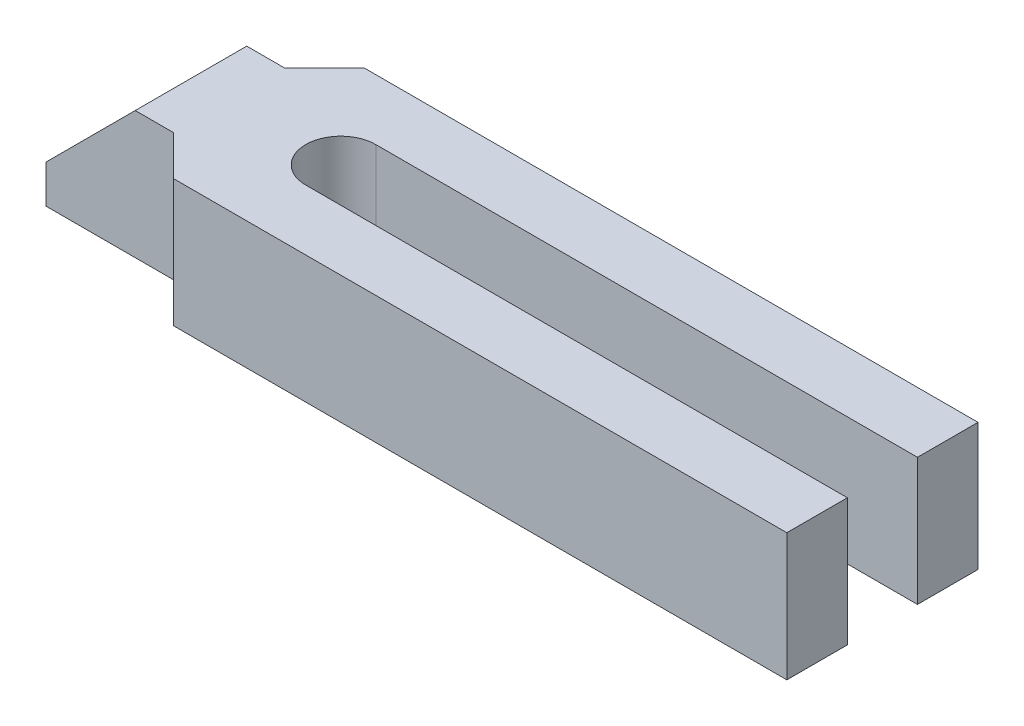
from build123d import *

# Parameters (mm, degrees)
BOSS_EXTRUDE1_DEPTH = 40
CHAMFER1_SIZE       = 28


with BuildPart() as part:
    # Sketch1 → Boss-Extrude1 (new body)
    with BuildSketch(Plane(origin=(0, 0, 0), x_dir=(1, 0, 0), z_dir=(0, 1, 0))):
        with BuildLine():
            Line((0, 0), (0, 17.5))
            Line((0, 17.5), (40, 17.5))
            Line((40, 17.5), (52.5, 30))
            Line((52.5, 30), (245, 30))
            Line((245, 30), (245, 11))
            Line((245, 11), (75, 11))
            ThreePointArc((75, 11), (64, 0), (75, -11))
            Line((75, -11), (245, -11))
            Line((245, -11), (245, -30))
            Line((245, -30), (52.5, -30))
            Line((52.5, -30), (40, -17.5))
            Line((40, -17.5), (0, -17.5))
            Line((0, -17.5), (0, 0))
        make_face()
    extrude(amount=BOSS_EXTRUDE1_DEPTH)

    # Chamfer1
    chamfer1_edges = [part.edges().sort_by_distance(p)[0] for p in [
        (0, 40, 0),
    ]]
    chamfer(chamfer1_edges, length=CHAMFER1_SIZE)


solid = part.part
